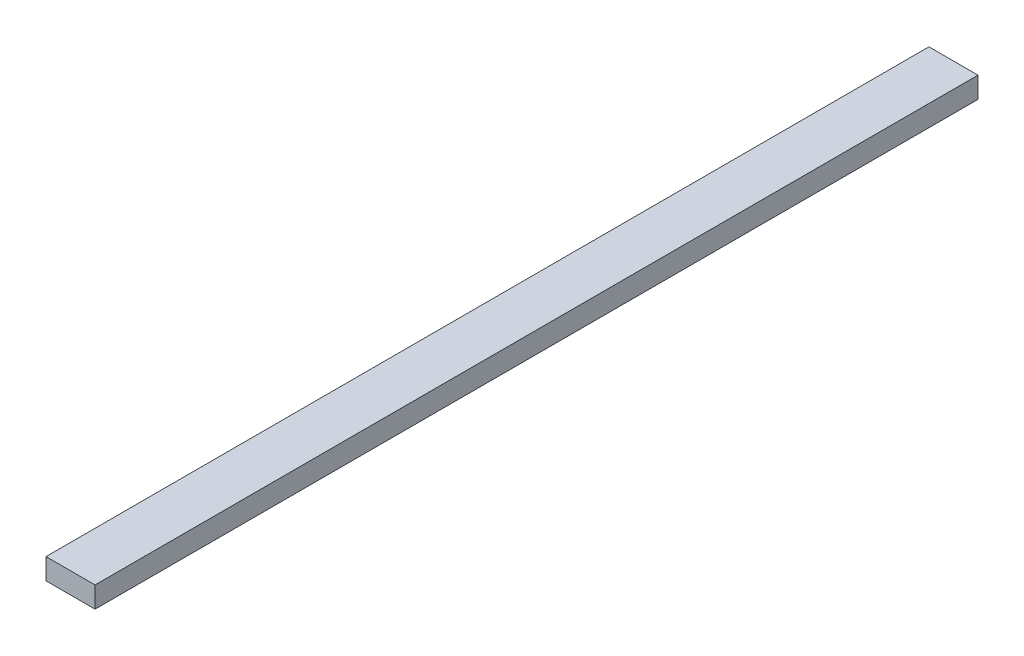
from build123d import *

# Parameters (mm, degrees)
SKETCH1_W           = 88.9
SKETCH1_H           = 38.1
BOSS_EXTRUDE1_DEPTH = 1600.2


with BuildPart() as part:
    # Sketch1 → Boss-Extrude1 (new body)
    with BuildSketch(Plane.XY):
        with Locations((44.45, -19.05)):
            Rectangle(SKETCH1_W, SKETCH1_H)
    extrude(amount=BOSS_EXTRUDE1_DEPTH)


solid = part.part
